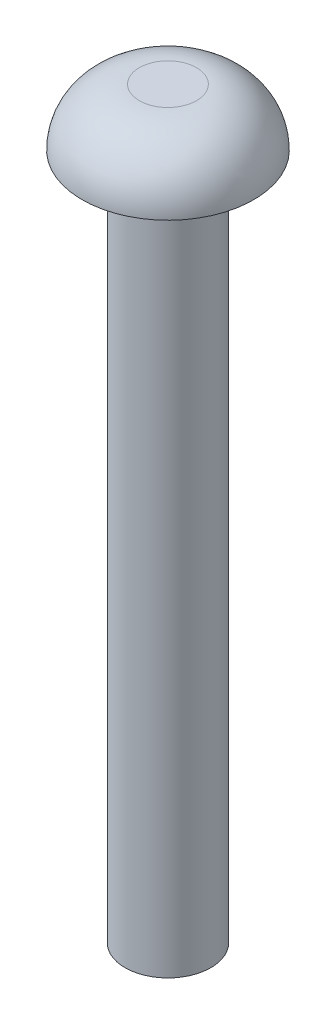
from build123d import *

# Parameters (mm, degrees)
SKETCH1_W = 6
SKETCH1_H = 96


with BuildPart() as part:
    # Sketch1 → Revolve2 (revolve)
    with BuildSketch(Plane.XY):
        with Locations((3, -48)):
            Rectangle(SKETCH1_W, SKETCH1_H)
        with BuildLine():
            Line((6, 8), (2, 8))
            ThreePointArc((2, 8), (-3.656854249, 5.656854249), (-6, 0))
            Line((-6, 0), (6, 0))
            Line((6, 0), (6, 8))
        make_face()
    revolve(axis=Axis((6, 0, 0), (0, -1, 0)))


solid = part.part
